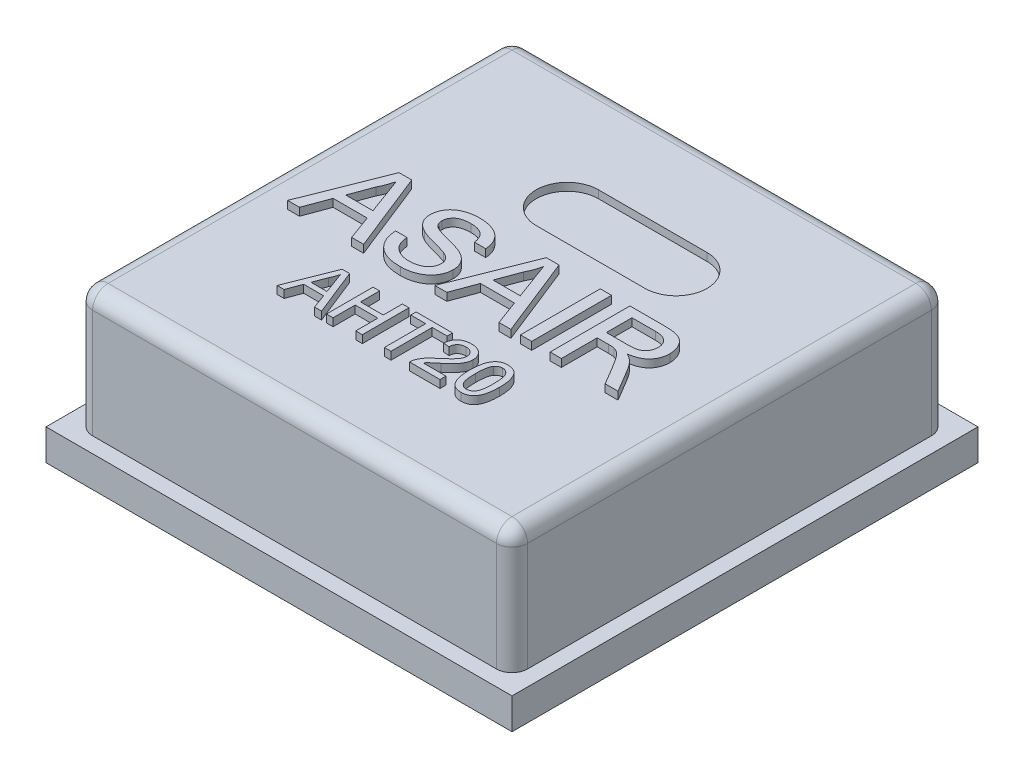
from build123d import *

# Parameters (mm, degrees)
SKETCH_1_W          = 3
SKETCH_1_H          = 3
EXTRUDE_1_DEPTH     = 0.2
SKETCH_5_W          = 0.55
SKETCH_5_H          = 0.4
EXTRUDE_4_DEPTH     = 0.05
EXTRUDE_5_DEPTH     = 0.8
FILLET_2_R          = 0.1
CUT_EXTRUDE_2_DEPTH = 0.05
SKETCH_8_W          = 0.072439758
SKETCH_8_H          = 0.513663737
EXTRUDE_6_DEPTH     = 0.05


with BuildPart() as part:
    # Эскиз1 → Бобышка-Вытянуть1 (new body)
    with BuildSketch(Plane(origin=(0, 0, 0), x_dir=(1, 0, 0), z_dir=(0, 1, 0))):
        Rectangle(SKETCH_1_W, SKETCH_1_H)
    extrude(amount=EXTRUDE_1_DEPTH)

    # Эскиз5 → Бобышка-Вытянуть4 (add)
    with BuildSketch(Plane.XZ):
        with Locations((-1, -1)):
            Rectangle(SKETCH_5_W, SKETCH_5_H)
        with Locations((1, -1)):
            Rectangle(SKETCH_5_W, SKETCH_5_H)
        with Locations((-1, 0)):
            Rectangle(SKETCH_5_W, SKETCH_5_H)
        with Locations((-1, 1)):
            Rectangle(SKETCH_5_W, SKETCH_5_H)
        with Locations((1, 0)):
            Rectangle(SKETCH_5_W, SKETCH_5_H)
        with Locations((1, 1)):
            Rectangle(SKETCH_5_W, SKETCH_5_H)
    extrude(amount=EXTRUDE_4_DEPTH)

    # Эскиз6 → Бобышка-Вытянуть5 (add)
    with BuildSketch(Plane(origin=(0, 0.2, 0), x_dir=(1, 0, 0), z_dir=(0, 1, 0))):
        with BuildLine():
            Line((-1.3, 1.4), (1.3, 1.4))
            ThreePointArc((1.3, 1.4), (1.370710678, 1.370710678), (1.4, 1.3))
            Line((1.4, 1.3), (1.4, -1.3))
            ThreePointArc((1.4, -1.3), (1.370710678, -1.370710678), (1.3, -1.4))
            Line((1.3, -1.4), (-1.3, -1.4))
            ThreePointArc((-1.3, -1.4), (-1.370710678, -1.370710678), (-1.4, -1.3))
            Line((-1.4, -1.3), (-1.4, 1.3))
            ThreePointArc((-1.4, 1.3), (-1.370710678, 1.370710678), (-1.3, 1.4))
        make_face()
    extrude(amount=EXTRUDE_5_DEPTH)

    # Скругление2
    fillet_2_edges = [part.edges().sort_by_distance(p)[0] for p in [
        (1.370710678, 1, -1.370710678),
        (0, 1, -1.4),
        (-1.370710678, 1, -1.370710678),
        (-1.4, 1, 0),
        (-1.370710678, 1, 1.370710678),
        (0, 1, 1.4),
        (1.370710678, 1, 1.370710678),
        (1.4, 1, 0),
    ]]
    fillet(fillet_2_edges, radius=FILLET_2_R)

    # Эскиз7 → Вырез-Вытянуть2 (cut)
    with BuildSketch(Plane(origin=(0, 1, 0), x_dir=(1, 0, 0), z_dir=(0, 1, 0))):
        with BuildLine():
            Line((-0.243969504, 0.8), (0.456030496, 0.8))
            ThreePointArc((0.456030496, 0.8), (0.656030496, 0.6), (0.456030496, 0.4))
            Line((0.456030496, 0.4), (-0.243969504, 0.4))
            ThreePointArc((-0.243969504, 0.4), (-0.443969504, 0.6), (-0.243969504, 0.8))
        make_face()
    extrude(amount=-CUT_EXTRUDE_2_DEPTH, mode=Mode.SUBTRACT)

    # Эскиз8 → Бобышка-Вытянуть6 (add)
    # profile 1 of 10: a face of its own
    with BuildSketch(Plane(origin=(0, 1, 0), x_dir=(1, 0, 0), z_dir=(0, 1, 0))):
        Polygon((-1.134869538, -0.309961255), (-0.930926924, 0.203702482), (-0.849226402, 0.203702482), (-0.645283788, -0.309961255), (-0.722148134, -0.309961255), (-0.780593847, -0.151910874), (-0.999559479, -0.151910874), (-1.058005192, -0.309961255), align=None)
        with BuildLine():
            Line((-0.977745233, -0.092641982), (-0.802408092, -0.092641982))
            Line((-0.802408092, -0.092641982), (-0.852313323, 0.042359385))
            add(Edge.make_bspline(
                [(-0.852313323, 0.042359385), (-0.854226512, 0.047575654), (-0.857967156, 0.057774445), (-0.863545584, 0.072592426), (-0.868641946, 0.08666419), (-0.873639347, 0.099787966), (-0.878150591, 0.112154392), (-0.882308719, 0.123679937), (-0.886421074, 0.134284493), (-0.888888955, 0.141136129), (-0.890076663, 0.144433589)],
                knots=[0, 0, 0, 0, 1.225184869, 2.395467751, 3.491410812, 4.525364584, 5.492066482, 6.394148129, 7.227157926, 8, 8, 8, 8], degree=3))
            add(Edge.make_bspline(
                [(-0.890076663, 0.144433589), (-0.892041361, 0.136302343), (-0.895978858, 0.120006322), (-0.904223017, 0.096130466), (-0.91365405, 0.072472965), (-0.921313172, 0.057228233), (-0.925164671, 0.049562202)],
                knots=[0, 0, 0, 0, 0.9891762, 1.982431084, 2.985436691, 4, 4, 4, 4], degree=3))
            Line((-0.925164671, 0.049562202), (-0.977745233, -0.092641982))
        make_face(mode=Mode.SUBTRACT)
    # profile 2 of 10: a face of its own
    with BuildSketch(Plane(origin=(0, 1, 0), x_dir=(1, 0, 0), z_dir=(0, 1, 0))):
        with BuildLine():
            Line((-0.616781213, -0.132154577), (-0.544341455, -0.132154577))
            add(Edge.make_bspline(
                [(-0.544341455, -0.132154577), (-0.54354466, -0.138658671), (-0.542013973, -0.151153386), (-0.53773402, -0.168862764), (-0.532225445, -0.184785312), (-0.525361912, -0.19913235), (-0.516333195, -0.211731859), (-0.505455145, -0.223096424), (-0.492244345, -0.232937449), (-0.477332363, -0.241695317), (-0.460724577, -0.248571628), (-0.442994284, -0.25366915), (-0.424226043, -0.256689473), (-0.411374706, -0.257078931), (-0.404812604, -0.257277795)],
                knots=[0, 0, 0, 0, 1.125557648, 2.162256852, 3.1243583, 4.018160113, 4.88511607, 5.777380551, 6.711250965, 7.707237736, 8.743031335, 9.791730543, 10.872421559, 12, 12, 12, 12], degree=3))
            add(Edge.make_bspline(
                [(-0.404812604, -0.257277795), (-0.399005708, -0.257170315), (-0.387683386, -0.256960751), (-0.371304383, -0.254443367), (-0.355891692, -0.250872525), (-0.341732162, -0.245471068), (-0.328878024, -0.238912005), (-0.317715646, -0.230978664), (-0.308185801, -0.222032035), (-0.300723242, -0.211836469), (-0.294860804, -0.201153221), (-0.2905601, -0.190171943), (-0.287998259, -0.178953587), (-0.287671814, -0.171405299), (-0.287509587, -0.167654174)],
                knots=[0, 0, 0, 0, 1.267006637, 2.470417599, 3.611360613, 4.716023143, 5.771382139, 6.754486395, 7.697536124, 8.612899418, 9.501261124, 10.352596716, 11.181322154, 12, 12, 12, 12], degree=3))
            add(Edge.make_bspline(
                [(-0.287509587, -0.167654174), (-0.287683011, -0.163941045), (-0.288021967, -0.156683741), (-0.290230853, -0.146118012), (-0.294429153, -0.136447301), (-0.299876929, -0.127276895), (-0.307455716, -0.118892545), (-0.317030658, -0.111167114), (-0.328812715, -0.104163164), (-0.337606248, -0.100327393), (-0.342250995, -0.098301338)],
                knots=[0, 0, 0, 0, 0.942140154, 1.841411588, 2.718743672, 3.605002079, 4.535543111, 5.568170452, 6.715506882, 8, 8, 8, 8], degree=3))
            add(Edge.make_bspline(
                [(-0.342250995, -0.098301338), (-0.344060657, -0.097558712), (-0.348149012, -0.095880986), (-0.355156261, -0.093659965), (-0.36347125, -0.090787959), (-0.373293739, -0.08783026), (-0.384571144, -0.084701428), (-0.39728469, -0.081160065), (-0.411427272, -0.077394019), (-0.426597782, -0.073385474), (-0.441915374, -0.069309397), (-0.456549545, -0.065229504), (-0.470013677, -0.061087889), (-0.48241806, -0.057100087), (-0.493698745, -0.053095831), (-0.503887749, -0.049184751), (-0.512997774, -0.045446198), (-0.518561831, -0.042697297), (-0.521189544, -0.041399085)],
                knots=[0, 0, 0, 0, 0.499201778, 1.127787504, 1.87543728, 2.745208432, 3.745951656, 4.863402235, 6.114490242, 7.482339553, 8.869366102, 10.161191451, 11.360587006, 12.46547846, 13.487450326, 14.41601931, 15.251940103, 16, 16, 16, 16], degree=3))
            add(Edge.make_bspline(
                [(-0.521189544, -0.041399085), (-0.52723518, -0.038133058), (-0.538904831, -0.031828776), (-0.554610889, -0.020556703), (-0.567844837, -0.008048252), (-0.578550843, 0.00567844), (-0.586940722, 0.020391221), (-0.592601337, 0.036115103), (-0.59647839, 0.052564669), (-0.596840711, 0.063876324), (-0.597024916, 0.069627192)],
                knots=[0, 0, 0, 0, 1.158441928, 2.236094408, 3.251151369, 4.220012324, 5.163146324, 6.095083285, 7.031536583, 8, 8, 8, 8], degree=3))
            add(Edge.make_bspline(
                [(-0.597024916, 0.069627192), (-0.596780439, 0.075995307), (-0.596294178, 0.088661441), (-0.591980774, 0.107248203), (-0.585100813, 0.125133612), (-0.577269327, 0.1393331), (-0.569631898, 0.15007069), (-0.563300411, 0.157803706), (-0.55619841, 0.164951839), (-0.548544612, 0.171614873), (-0.540202198, 0.177693255), (-0.531378143, 0.183436798), (-0.521753067, 0.188373511), (-0.508228403, 0.194656832), (-0.490135661, 0.200931316), (-0.467359163, 0.206398733), (-0.443387646, 0.209618381), (-0.427048097, 0.21006158), (-0.41870375, 0.210287915)],
                knots=[0, 0, 0, 0, 1.199927478, 2.386647047, 3.578628709, 4.806592355, 5.433127754, 6.062729195, 6.689531802, 7.331674828, 7.974827539, 8.635320743, 9.315455226, 10.01318112, 11.447700238, 12.918145351, 14.426146008, 16, 16, 16, 16], degree=3))
            add(Edge.make_bspline(
                [(-0.41870375, 0.210287915), (-0.409570308, 0.210078636), (-0.391785737, 0.209671129), (-0.365944252, 0.206280751), (-0.341841221, 0.20045858), (-0.322938797, 0.193941243), (-0.308964456, 0.187343324), (-0.299036696, 0.182195035), (-0.28982177, 0.176242675), (-0.281236728, 0.16980129), (-0.273201824, 0.162873821), (-0.265923575, 0.155295489), (-0.259085939, 0.147324851), (-0.251050763, 0.135881512), (-0.24238714, 0.120736317), (-0.234896259, 0.101115116), (-0.229749936, 0.080406549), (-0.228748858, 0.066090187), (-0.228240694, 0.058822967)],
                knots=[0, 0, 0, 0, 1.607600973, 3.130308851, 4.577334065, 5.967726088, 6.640410691, 7.296826776, 7.935019992, 8.569057421, 9.185393759, 9.8003086, 10.417295362, 11.032210203, 12.259799365, 13.477607022, 14.719591916, 16, 16, 16, 16], degree=3))
            Line((-0.228240694, 0.058822967), (-0.300680452, 0.058822967))
            add(Edge.make_bspline(
                [(-0.300680452, 0.058822967), (-0.301140723, 0.062501119), (-0.302041338, 0.069698174), (-0.304275645, 0.080116994), (-0.307407692, 0.089793525), (-0.31107628, 0.098818007), (-0.315523377, 0.107096577), (-0.320707404, 0.114708725), (-0.326691494, 0.121564769), (-0.333321668, 0.12784587), (-0.340799682, 0.133314957), (-0.349087111, 0.138062291), (-0.358197945, 0.142072702), (-0.368124157, 0.145357359), (-0.378867712, 0.147904154), (-0.390453048, 0.149777625), (-0.402875685, 0.150737113), (-0.411430961, 0.150923397), (-0.415822624, 0.151019022)],
                knots=[0, 0, 0, 0, 1.074487479, 2.102453544, 3.083708351, 4.020042547, 4.923259678, 5.803182661, 6.684453325, 7.556870173, 8.445961597, 9.363679789, 10.320905216, 11.327237703, 12.390948353, 13.519046902, 14.726457512, 16, 16, 16, 16], degree=3))
            add(Edge.make_bspline(
                [(-0.415822624, 0.151019022), (-0.420387552, 0.150984614), (-0.42922413, 0.150918008), (-0.441998406, 0.149703864), (-0.453838509, 0.148038017), (-0.464724101, 0.14558075), (-0.474619524, 0.14236418), (-0.483671639, 0.138649779), (-0.491627114, 0.133942663), (-0.498671404, 0.128699548), (-0.504747996, 0.12289833), (-0.509985119, 0.11678525), (-0.514616949, 0.110539914), (-0.518215984, 0.103820946), (-0.521146139, 0.096882806), (-0.52303641, 0.089595078), (-0.524374767, 0.082092566), (-0.524514058, 0.076973453), (-0.524585158, 0.074360471)],
                knots=[0, 0, 0, 0, 1.464176581, 2.834285765, 4.113735764, 5.29917439, 6.409476712, 7.449999357, 8.431575861, 9.367089851, 10.262376129, 11.120706676, 11.948504824, 12.751342953, 13.560717798, 14.359016663, 15.162382702, 16, 16, 16, 16], degree=3))
            add(Edge.make_bspline(
                [(-0.524585158, 0.074360471), (-0.524397956, 0.069941134), (-0.524034616, 0.061363609), (-0.520324377, 0.04917753), (-0.514618003, 0.03806913), (-0.508996316, 0.032025107), (-0.506166526, 0.028982725)],
                knots=[0, 0, 0, 0, 1.050964922, 2.039826012, 3.013306874, 4, 4, 4, 4], degree=3))
            add(Edge.make_bspline(
                [(-0.506166526, 0.028982725), (-0.504382657, 0.027462289), (-0.50043774, 0.024099937), (-0.493097615, 0.019650259), (-0.483996947, 0.015154425), (-0.473074929, 0.010685219), (-0.460350352, 0.006188384), (-0.445843742, 0.00155834), (-0.429499843, -0.00304016), (-0.411816735, -0.007471575), (-0.393952674, -0.011920805), (-0.37697581, -0.016353078), (-0.361388175, -0.020553652), (-0.3472145, -0.024650625), (-0.334440115, -0.028632411), (-0.323109416, -0.032582433), (-0.313130733, -0.036215452), (-0.30701761, -0.038771577), (-0.304178963, -0.039958521)],
                knots=[0, 0, 0, 0, 0.523891492, 1.158553688, 1.913783773, 2.794766643, 3.797521443, 4.933638669, 6.202080764, 7.596537849, 9.013317056, 10.322179469, 11.523240428, 12.626146501, 13.623953177, 14.517289671, 15.311498917, 16, 16, 16, 16], degree=3))
            add(Edge.make_bspline(
                [(-0.304178963, -0.039958521), (-0.300485739, -0.041661335), (-0.293236559, -0.045003672), (-0.282967125, -0.05071021), (-0.273384629, -0.056636143), (-0.264566491, -0.062941017), (-0.256541225, -0.069638093), (-0.249219098, -0.076650638), (-0.242555888, -0.083939241), (-0.236820454, -0.091737179), (-0.231670622, -0.099729224), (-0.227164177, -0.108027075), (-0.223535674, -0.116679531), (-0.22035325, -0.125582295), (-0.218064174, -0.13483439), (-0.216269078, -0.144342364), (-0.215222028, -0.154150908), (-0.215121001, -0.160791914), (-0.215069829, -0.164155663)],
                knots=[0, 0, 0, 0, 1.198900896, 2.353241543, 3.461831299, 4.520043694, 5.547003373, 6.541368882, 7.508191797, 8.454912692, 9.392021408, 10.310662301, 11.235020644, 12.156274873, 13.095836685, 14.042125239, 15.00831306, 16, 16, 16, 16], degree=3))
            add(Edge.make_bspline(
                [(-0.215069829, -0.164155663), (-0.2153379, -0.170868791), (-0.215870111, -0.184196582), (-0.220452638, -0.203842362), (-0.227651545, -0.222879013), (-0.236094047, -0.237985644), (-0.244074763, -0.249524915), (-0.250778941, -0.257818816), (-0.258213489, -0.26548779), (-0.266195375, -0.272772094), (-0.274786573, -0.279523103), (-0.28405951, -0.285743116), (-0.293916316, -0.291496883), (-0.307991587, -0.298508185), (-0.326685885, -0.305842672), (-0.350498668, -0.311950585), (-0.375594456, -0.315912939), (-0.392826774, -0.316332518), (-0.401622785, -0.316546687)],
                knots=[0, 0, 0, 0, 1.197055466, 2.376552968, 3.581957237, 4.820753935, 5.454298064, 6.085440993, 6.72202542, 7.359198513, 8.013298489, 8.67051481, 9.351020706, 10.049282741, 11.476266879, 12.925760103, 14.430794493, 16, 16, 16, 16], degree=3))
            add(Edge.make_bspline(
                [(-0.401622785, -0.316546687), (-0.407215471, -0.316500534), (-0.418170745, -0.316410126), (-0.434268296, -0.315315258), (-0.449694873, -0.313731477), (-0.464435337, -0.311372418), (-0.478443465, -0.30827746), (-0.491769537, -0.304561014), (-0.504445142, -0.30028076), (-0.51642599, -0.295247256), (-0.527680806, -0.289398874), (-0.538411963, -0.283089949), (-0.548444053, -0.275938487), (-0.557798195, -0.268056863), (-0.566711402, -0.259672769), (-0.57481425, -0.250443805), (-0.582382215, -0.240639861), (-0.589242369, -0.230171206), (-0.595370873, -0.219174805), (-0.600882143, -0.207835331), (-0.605525466, -0.196070525), (-0.609267543, -0.183939846), (-0.612437271, -0.171524473), (-0.614635404, -0.15872082), (-0.616251545, -0.145569088), (-0.616603614, -0.136652492), (-0.616781213, -0.132154577)],
                knots=[0, 0, 0, 0, 1.259822038, 2.467811403, 3.633536148, 4.752793854, 5.829021491, 6.863980041, 7.868367876, 8.841470325, 9.788447787, 10.724101269, 11.643985084, 12.560193707, 13.478453146, 14.398077254, 15.323914234, 16.266973849, 17.21495974, 18.158525798, 19.105629373, 20.061269543, 21.017128399, 21.990322895, 22.986232211, 24, 24, 24, 24], degree=3))
        make_face()
    # profile 3 of 10: a face of its own
    with BuildSketch(Plane(origin=(0, 1, 0), x_dir=(1, 0, 0), z_dir=(0, 1, 0))):
        Polygon((-0.186567254, -0.309961255), (0.01737536, 0.203702482), (0.099075882, 0.203702482), (0.303018495, -0.309961255), (0.22615415, -0.309961255), (0.167708436, -0.151910874), (-0.051257195, -0.151910874), (-0.109702909, -0.309961255), align=None)
        with BuildLine():
            Line((-0.02944295, -0.092641982), (0.145894191, -0.092641982))
            Line((0.145894191, -0.092641982), (0.09598896, 0.042359385))
            add(Edge.make_bspline(
                [(0.09598896, 0.042359385), (0.094075772, 0.047575654), (0.090335127, 0.057774445), (0.0847567, 0.072592426), (0.079660338, 0.08666419), (0.074662936, 0.099787966), (0.070151693, 0.112154392), (0.065993564, 0.123679937), (0.06188121, 0.134284493), (0.059413329, 0.141136129), (0.058225621, 0.144433589)],
                knots=[0, 0, 0, 0, 1.225184869, 2.395467751, 3.491410812, 4.525364584, 5.492066482, 6.394148129, 7.227157926, 8, 8, 8, 8], degree=3))
            add(Edge.make_bspline(
                [(0.058225621, 0.144433589), (0.056260923, 0.136302343), (0.052323426, 0.120006322), (0.044079266, 0.096130466), (0.034648234, 0.072472965), (0.026989112, 0.057228233), (0.023137613, 0.049562202)],
                knots=[0, 0, 0, 0, 0.9891762, 1.982431084, 2.985436691, 4, 4, 4, 4], degree=3))
            Line((0.023137613, 0.049562202), (-0.02944295, -0.092641982))
        make_face(mode=Mode.SUBTRACT)
    # profile 4 of 10: a face of its own
    with BuildSketch(Plane(origin=(0, 1, 0), x_dir=(1, 0, 0), z_dir=(0, 1, 0))):
        with Locations((0.400668112, -0.053129387)):
            Rectangle(SKETCH_8_W, SKETCH_8_H)
    # profile 5 of 10: a face of its own
    with BuildSketch(Plane(origin=(0, 1, 0), x_dir=(1, 0, 0), z_dir=(0, 1, 0))):
        with BuildLine():
            Line((0.555425776, -0.309961255), (0.555425776, 0.203702482))
            Line((0.555425776, 0.203702482), (0.778301508, 0.203702482))
            add(Edge.make_bspline(
                [(0.778301508, 0.203702482), (0.783549549, 0.203661362), (0.793706519, 0.203581778), (0.808436221, 0.203018413), (0.822184922, 0.201803946), (0.8349779, 0.20049067), (0.846812882, 0.198474966), (0.85767766, 0.196162999), (0.867589006, 0.193411724), (0.876591231, 0.190162256), (0.884943334, 0.186485969), (0.892685102, 0.181950025), (0.90013835, 0.176979597), (0.907026464, 0.171140087), (0.913531118, 0.164746363), (0.919646282, 0.157711549), (0.925281427, 0.149974598), (0.932231703, 0.138901415), (0.939687933, 0.124154268), (0.945900143, 0.105281115), (0.949905665, 0.085539108), (0.950334268, 0.072047733), (0.950551728, 0.065202604)],
                knots=[0, 0, 0, 0, 1.242255013, 2.404239178, 3.487702428, 4.508875116, 5.447164253, 6.327763259, 7.137389581, 7.87956647, 8.591787438, 9.293660819, 10.000726923, 10.709654955, 11.427269343, 12.158170644, 12.913245971, 13.690346794, 15.251572448, 16.809945773, 18.381459854, 20, 20, 20, 20], degree=3))
            add(Edge.make_bspline(
                [(0.950551728, 0.065202604), (0.950451213, 0.060808642), (0.950252689, 0.052130266), (0.948731974, 0.039370729), (0.945980363, 0.027179505), (0.942451964, 0.015449825), (0.937622662, 0.004347879), (0.932028126, -0.006353092), (0.925097291, -0.016359105), (0.917337455, -0.025936604), (0.908439004, -0.034880464), (0.898323659, -0.042868012), (0.88709169, -0.050052829), (0.874690199, -0.05623668), (0.861261941, -0.061889014), (0.846638427, -0.066440546), (0.830878677, -0.07015722), (0.819953286, -0.071956978), (0.814315593, -0.072885684)],
                knots=[0, 0, 0, 0, 0.982609109, 1.940720374, 2.867584677, 3.775009516, 4.675469332, 5.571146231, 6.471115823, 7.392408543, 8.32534739, 9.286126426, 10.269214477, 11.301811357, 12.381622301, 13.524260118, 14.722474812, 16, 16, 16, 16], degree=3))
            add(Edge.make_bspline(
                [(0.814315593, -0.072885684), (0.818451054, -0.074974828), (0.826304445, -0.078942188), (0.837177562, -0.085162973), (0.846394327, -0.091519083), (0.851734065, -0.09606516), (0.854239777, -0.09819844)],
                knots=[0, 0, 0, 0, 1.172304973, 2.226249348, 3.167654437, 4, 4, 4, 4], degree=3))
            add(Edge.make_bspline(
                [(0.854239777, -0.09819844), (0.85909223, -0.102955262), (0.869059512, -0.112726111), (0.882794859, -0.129368729), (0.896111751, -0.147894518), (0.904202766, -0.161283167), (0.908363801, -0.168168661)],
                knots=[0, 0, 0, 0, 0.918110279, 1.885863737, 2.912745394, 4, 4, 4, 4], degree=3))
            Line((0.908363801, -0.168168661), (0.992636758, -0.309961255))
            Line((0.992636758, -0.309961255), (0.909598569, -0.309961255))
            Line((0.909598569, -0.309961255), (0.845596397, -0.201507413))
            add(Edge.make_bspline(
                [(0.845596397, -0.201507413), (0.8432952, -0.19770218), (0.838835859, -0.190328262), (0.832394501, -0.17955901), (0.82607896, -0.169644198), (0.820221404, -0.160300455), (0.814584124, -0.151697412), (0.809221588, -0.143805184), (0.804281376, -0.136520234), (0.798162285, -0.128038657), (0.79104068, -0.118653713), (0.782730255, -0.108988993), (0.774816266, -0.10128344), (0.765070043, -0.093727327), (0.752997871, -0.086659852), (0.742736297, -0.083412542), (0.737759939, -0.081837756)],
                knots=[0, 0, 0, 0, 1.130940588, 2.191577161, 3.191089816, 4.120344442, 4.99615009, 5.80661983, 6.546979556, 7.234477901, 8.466216387, 9.541989141, 10.473533583, 11.269175393, 12.675684693, 14, 14, 14, 14], degree=3))
            add(Edge.make_bspline(
                [(0.737759939, -0.081837756), (0.735672044, -0.081461238), (0.730905317, -0.080601635), (0.722811426, -0.080040227), (0.713004684, -0.079444367), (0.705897571, -0.079461729), (0.702054547, -0.079471116)],
                knots=[0, 0, 0, 0, 0.709978628, 1.620902492, 2.713552433, 4, 4, 4, 4], degree=3))
            Line((0.702054547, -0.079471116), (0.627865534, -0.079471116))
            Line((0.627865534, -0.079471116), (0.627865534, -0.309961255))
            Line((0.627865534, -0.309961255), (0.555425776, -0.309961255))
        make_face()
        with BuildLine():
            Line((0.627865534, -0.020202224), (0.765439336, -0.020202224))
            add(Edge.make_bspline(
                [(0.765439336, -0.020202224), (0.772337807, -0.020094291), (0.785233853, -0.01989252), (0.803266932, -0.018169609), (0.818635128, -0.01543183), (0.831642248, -0.011438459), (0.842570282, -0.005894333), (0.8520746, 0.000862219), (0.859972809, 0.009325505), (0.866543303, 0.01887452), (0.871650682, 0.029382736), (0.875334902, 0.040420075), (0.877746288, 0.051893777), (0.877988996, 0.05970262), (0.87811197, 0.063659144)],
                knots=[0, 0, 0, 0, 1.546323217, 2.890706218, 4.056530419, 5.041445823, 5.928701482, 6.793137403, 7.641659452, 8.509781392, 9.383301667, 10.251423607, 11.114044887, 12, 12, 12, 12], degree=3))
            add(Edge.make_bspline(
                [(0.87811197, 0.063659144), (0.878016363, 0.066542413), (0.877829097, 0.072189891), (0.876847388, 0.08047882), (0.874938712, 0.088355219), (0.872418309, 0.095860722), (0.86905054, 0.102940358), (0.865049768, 0.109648987), (0.860275612, 0.115949425), (0.854807091, 0.121860865), (0.848528235, 0.127239697), (0.841356305, 0.131880464), (0.833347866, 0.135824114), (0.824493609, 0.138954058), (0.814821428, 0.141457504), (0.804276259, 0.143122966), (0.79290633, 0.144328088), (0.785027628, 0.144397765), (0.78097684, 0.144433589)],
                knots=[0, 0, 0, 0, 0.965208469, 1.890559848, 2.786986821, 3.67262109, 4.535197034, 5.405224191, 6.282113641, 7.175449223, 8.095446547, 9.040936516, 10.026471658, 11.075712529, 12.17809725, 13.364958037, 14.645208957, 16, 16, 16, 16], degree=3))
            Line((0.78097684, 0.144433589), (0.627865534, 0.144433589))
            Line((0.627865534, 0.144433589), (0.627865534, -0.020202224))
        make_face(mode=Mode.SUBTRACT)
    # profile 6 of 10: a face of its own
    with BuildSketch(Plane(origin=(0, 1, 0), x_dir=(1, 0, 0), z_dir=(0, 1, 0))):
        Polygon((-0.694344299, -0.817897763), (-0.575233722, -0.517897763), (-0.527517376, -0.517897763), (-0.408406799, -0.817897763), (-0.453298626, -0.817897763), (-0.487433242, -0.72559007), (-0.615317857, -0.72559007), (-0.649452472, -0.817897763), align=None)
        with BuildLine():
            Line((-0.602577472, -0.690974686), (-0.500173626, -0.690974686))
            Line((-0.500173626, -0.690974686), (-0.529320261, -0.612128532))
            add(Edge.make_bspline(
                [(-0.529320261, -0.612128532), (-0.530437639, -0.609082024), (-0.532622323, -0.603125526), (-0.535880347, -0.594471237), (-0.538856824, -0.586252769), (-0.541775505, -0.578587962), (-0.54441025, -0.571365479), (-0.546838762, -0.564634104), (-0.54924054, -0.558440622), (-0.550681881, -0.554438995), (-0.551375549, -0.552513147)],
                knots=[0, 0, 0, 0, 1.225184869, 2.395467751, 3.491410812, 4.525364584, 5.492066482, 6.394148129, 7.227157926, 8, 8, 8, 8], degree=3))
            add(Edge.make_bspline(
                [(-0.551375549, -0.552513147), (-0.552523011, -0.557262118), (-0.554822665, -0.56677964), (-0.559637581, -0.580724088), (-0.565145678, -0.594541007), (-0.56961891, -0.603444535), (-0.571868338, -0.607921801)],
                knots=[0, 0, 0, 0, 0.9891762, 1.982431084, 2.985436691, 4, 4, 4, 4], degree=3))
            Line((-0.571868338, -0.607921801), (-0.602577472, -0.690974686))
        make_face(mode=Mode.SUBTRACT)
    # profile 7 of 10: a face of its own
    with BuildSketch(Plane(origin=(0, 1, 0), x_dir=(1, 0, 0), z_dir=(0, 1, 0))):
        Polygon((-0.376375549, -0.817897763), (-0.376375549, -0.517897763), (-0.334067857, -0.517897763), (-0.334067857, -0.640974686), (-0.187914011, -0.640974686), (-0.187914011, -0.517897763), (-0.145606318, -0.517897763), (-0.145606318, -0.817897763), (-0.187914011, -0.817897763), (-0.187914011, -0.67559007), (-0.334067857, -0.67559007), (-0.334067857, -0.817897763), align=None)
    # profile 8 of 10: a face of its own
    with BuildSketch(Plane(origin=(0, 1, 0), x_dir=(1, 0, 0), z_dir=(0, 1, 0))):
        Polygon((-0.003298626, -0.817897763), (-0.003298626, -0.552513147), (-0.099452472, -0.552513147), (-0.099452472, -0.517897763), (0.135162912, -0.517897763), (0.135162912, -0.552513147), (0.039009066, -0.552513147), (0.039009066, -0.817897763), align=None)
    # profile 9 of 10: a face of its own
    with BuildSketch(Plane(origin=(0, 1, 0), x_dir=(1, 0, 0), z_dir=(0, 1, 0))):
        with BuildLine():
            Line((0.354393682, -0.779436224), (0.354393682, -0.817897763))
            Line((0.354393682, -0.817897763), (0.158239835, -0.817897763))
            add(Edge.make_bspline(
                [(0.158239835, -0.817897763), (0.15823582, -0.815611885), (0.158227802, -0.811047792), (0.15900012, -0.804297788), (0.160209724, -0.797637329), (0.161577424, -0.793366241), (0.162266278, -0.79121507)],
                knots=[0, 0, 0, 0, 1.01057331, 2.01775941, 3.001627217, 4, 4, 4, 4], degree=3))
            add(Edge.make_bspline(
                [(0.162266278, -0.79121507), (0.16353905, -0.787700314), (0.166130625, -0.780543692), (0.171381183, -0.770217685), (0.17755708, -0.759954128), (0.183570185, -0.751598143), (0.189076891, -0.744922295), (0.193694981, -0.739699217), (0.198812672, -0.734352781), (0.204425865, -0.728883964), (0.210480536, -0.723257346), (0.216984947, -0.717454163), (0.224015904, -0.711582564), (0.228924248, -0.707690624), (0.231436951, -0.705698244)],
                knots=[0, 0, 0, 0, 1.204657718, 2.452881516, 3.728232997, 5.065887527, 5.768225529, 6.518857853, 7.313994055, 8.154655305, 9.046094665, 9.979688118, 10.965752482, 12, 12, 12, 12], degree=3))
            add(Edge.make_bspline(
                [(0.231436951, -0.705698244), (0.235297083, -0.702449233), (0.242730011, -0.696193058), (0.253226471, -0.686909474), (0.262813279, -0.67828914), (0.271337775, -0.670180967), (0.278869681, -0.6626636), (0.285426682, -0.655754071), (0.291065197, -0.649473941), (0.295716391, -0.643595898), (0.299640745, -0.63804539), (0.302966289, -0.632631212), (0.305737689, -0.627258791), (0.308045894, -0.621945126), (0.309871488, -0.616667493), (0.31111589, -0.611410517), (0.3119598, -0.60622636), (0.312044234, -0.602776764), (0.312085989, -0.60107084)],
                knots=[0, 0, 0, 0, 1.782554561, 3.432421876, 4.950675607, 6.337395053, 7.588547463, 8.709982106, 9.702713005, 10.569305638, 11.356701089, 12.103210377, 12.812277205, 13.490692607, 14.148717897, 14.782152033, 15.397739362, 16, 16, 16, 16], degree=3))
            add(Edge.make_bspline(
                [(0.312085989, -0.60107084), (0.312044229, -0.59938482), (0.311962298, -0.596076942), (0.311184942, -0.591235882), (0.3101028, -0.586573826), (0.308353306, -0.5821747), (0.306270882, -0.57790823), (0.303599669, -0.573909231), (0.300509626, -0.570078037), (0.296971787, -0.566515659), (0.293107639, -0.56317358), (0.288790005, -0.5603955), (0.284302465, -0.5578944), (0.279490202, -0.555883372), (0.274361038, -0.554406639), (0.268952308, -0.553334911), (0.263264873, -0.552655378), (0.259383598, -0.552561276), (0.257398489, -0.552513147)],
                knots=[0, 0, 0, 0, 0.988194508, 1.938783882, 2.870742509, 3.789494954, 4.709148727, 5.651055405, 6.603531303, 7.592354411, 8.592907906, 9.593461401, 10.59787167, 11.603930315, 12.645063138, 13.723588815, 14.835711238, 16, 16, 16, 16], degree=3))
            add(Edge.make_bspline(
                [(0.257398489, -0.552513147), (0.255313187, -0.552561038), (0.251232098, -0.552654763), (0.245266639, -0.553337006), (0.239603469, -0.554379382), (0.234256106, -0.555973085), (0.229231059, -0.557980759), (0.224548792, -0.560507886), (0.220134325, -0.563360555), (0.216126684, -0.5667379), (0.212502627, -0.570482687), (0.209285308, -0.574559627), (0.206649199, -0.579047397), (0.204472191, -0.583847321), (0.202721695, -0.588974488), (0.201450894, -0.594468093), (0.200758045, -0.600312276), (0.200618719, -0.60431437), (0.200547528, -0.606359301)],
                knots=[0, 0, 0, 0, 1.131143733, 2.213731411, 3.253917892, 4.251203413, 5.236093891, 6.184197493, 7.13373276, 8.082770301, 9.020476205, 9.957489029, 10.893177274, 11.836722509, 12.812818608, 13.827831385, 14.890097571, 16, 16, 16, 16], degree=3))
            Line((0.200547528, -0.606359301), (0.162085989, -0.602513147))
            add(Edge.make_bspline(
                [(0.162085989, -0.602513147), (0.162479505, -0.59916113), (0.163245057, -0.59264007), (0.165151943, -0.583195412), (0.167829037, -0.574409172), (0.171032406, -0.566158853), (0.175048131, -0.5585849), (0.179587563, -0.551530653), (0.184941613, -0.545219844), (0.190856418, -0.539453547), (0.197396781, -0.534371922), (0.204501265, -0.529932417), (0.212166621, -0.526219045), (0.220350155, -0.523144528), (0.229070655, -0.520811814), (0.238315783, -0.519139039), (0.248100409, -0.518107921), (0.254811802, -0.517968815), (0.258239835, -0.517897763)],
                knots=[0, 0, 0, 0, 1.130804643, 2.199883102, 3.223565206, 4.205909148, 5.160801384, 6.091796021, 7.01151579, 7.927798993, 8.855738875, 9.7815393, 10.730299821, 11.705391175, 12.706931101, 13.751121791, 14.851322166, 16, 16, 16, 16], degree=3))
            add(Edge.make_bspline(
                [(0.258239835, -0.517897763), (0.2617089, -0.517957167), (0.268466659, -0.518072886), (0.2783138, -0.519256923), (0.287604849, -0.52110105), (0.296373868, -0.523671199), (0.304569047, -0.52704143), (0.312196692, -0.531159092), (0.319291971, -0.535984017), (0.325736336, -0.541574127), (0.331547389, -0.547676668), (0.33663992, -0.554189394), (0.340897521, -0.561084484), (0.344522604, -0.568267952), (0.347211462, -0.575891581), (0.349102316, -0.583851726), (0.350387207, -0.592155188), (0.350493377, -0.597820659), (0.350547528, -0.600710263)],
                knots=[0, 0, 0, 0, 1.195390245, 2.328627238, 3.413424916, 4.457841177, 5.473507151, 6.462241215, 7.441013641, 8.425227782, 9.397253344, 10.342087291, 11.269524934, 12.186751184, 13.110685745, 14.048630397, 15.004728144, 16, 16, 16, 16], degree=3))
            add(Edge.make_bspline(
                [(0.350547528, -0.600710263), (0.35046484, -0.603679003), (0.350299283, -0.609623035), (0.349007087, -0.618507609), (0.346796124, -0.627295766), (0.343864978, -0.636094462), (0.339860422, -0.644938621), (0.334801346, -0.653950245), (0.32852501, -0.663162625), (0.322488933, -0.670994172), (0.316870326, -0.677558982), (0.311889962, -0.682962205), (0.306127968, -0.688702768), (0.2998005, -0.69497948), (0.292649492, -0.701569567), (0.28488041, -0.708670374), (0.276323184, -0.716095034), (0.270382801, -0.721167205), (0.267314355, -0.723787186)],
                knots=[0, 0, 0, 0, 0.927118007, 1.856282007, 2.79721255, 3.754929441, 4.749232485, 5.824981375, 6.979078785, 8.228161913, 8.911614355, 9.677694854, 10.522803217, 11.452009355, 12.461436787, 13.560019032, 14.739651695, 16, 16, 16, 16], degree=3))
            add(Edge.make_bspline(
                [(0.267314355, -0.723787186), (0.264686694, -0.725926382), (0.259676149, -0.7300055), (0.252547678, -0.735919106), (0.246162736, -0.741341723), (0.240372013, -0.746096474), (0.235386402, -0.750413342), (0.231030293, -0.754103267), (0.227461945, -0.757351776), (0.222027983, -0.762286326), (0.215145406, -0.769320029), (0.210074029, -0.776154482), (0.207638874, -0.779436224)],
                knots=[0, 0, 0, 0, 1.241996727, 2.368296581, 3.394949853, 4.3125351, 5.114548721, 5.812230366, 6.404953749, 6.883082049, 8.503329734, 10, 10, 10, 10], degree=3))
            Line((0.207638874, -0.779436224), (0.354393682, -0.779436224))
        make_face()
    # profile 10 of 10: a face of its own
    with BuildSketch(Plane(origin=(0, 1, 0), x_dir=(1, 0, 0), z_dir=(0, 1, 0))):
        with BuildLine():
            add(Edge.make_bspline(
                [(0.396701374, -0.669941032), (0.396740124, -0.665653757), (0.396816019, -0.65725679), (0.397286771, -0.644970518), (0.398108665, -0.633302755), (0.399335527, -0.622263633), (0.400788361, -0.611828235), (0.402677055, -0.602011453), (0.404802111, -0.592791261), (0.407351795, -0.58417727), (0.410153065, -0.576095415), (0.413331194, -0.568558662), (0.41690702, -0.561575002), (0.420704814, -0.555072009), (0.4249245, -0.549150832), (0.429311384, -0.543645298), (0.434184281, -0.538757318), (0.439340565, -0.534361123), (0.444856163, -0.530481736), (0.450701892, -0.527134294), (0.45685526, -0.524178743), (0.463433542, -0.521953806), (0.470300176, -0.52014001), (0.477508016, -0.51880576), (0.485065006, -0.518019174), (0.490229147, -0.517938691), (0.49285522, -0.517897763)],
                knots=[0, 0, 0, 0, 1.514747001, 2.966751498, 4.343369068, 5.64627492, 6.890416844, 8.064737671, 9.177176366, 10.232018008, 11.237056675, 12.19799043, 13.119080079, 14.007588942, 14.855863561, 15.685992447, 16.491747269, 17.290132607, 18.077525251, 18.870243746, 19.668095604, 20.485086593, 21.319398728, 22.175900658, 23.072407314, 24, 24, 24, 24], degree=3))
            add(Edge.make_bspline(
                [(0.49285522, -0.517897763), (0.496708011, -0.518011032), (0.504276974, -0.518233554), (0.5153277, -0.520048405), (0.525742296, -0.523152986), (0.535513997, -0.5273412), (0.544475757, -0.532661038), (0.552478986, -0.539128111), (0.559437358, -0.546674517), (0.56527493, -0.555389678), (0.570377552, -0.565033172), (0.574910609, -0.575648282), (0.57900836, -0.587223112), (0.581916214, -0.597584202), (0.583990384, -0.606528261), (0.58536332, -0.613905069), (0.586503131, -0.621864686), (0.587376381, -0.630387856), (0.588092862, -0.639465019), (0.588646167, -0.649101827), (0.588927027, -0.659322366), (0.588981207, -0.666335121), (0.589009066, -0.669941032)],
                knots=[0, 0, 0, 0, 1.134486744, 2.228744715, 3.287356444, 4.328707449, 5.352829806, 6.347195599, 7.349461267, 8.364207941, 9.428085653, 10.559314403, 11.761222316, 13.04268526, 13.726896727, 14.465273606, 15.252205015, 16.094778733, 16.988606776, 17.934225168, 18.937792761, 20, 20, 20, 20], degree=3))
            add(Edge.make_bspline(
                [(0.589009066, -0.669941032), (0.58896959, -0.674208169), (0.588892466, -0.682544862), (0.588434329, -0.694732618), (0.58756291, -0.706312354), (0.586490612, -0.717310595), (0.584868451, -0.72769798), (0.583120484, -0.737518645), (0.580958682, -0.746727993), (0.578436365, -0.755330061), (0.575595664, -0.763370334), (0.572480396, -0.770909575), (0.569029937, -0.777942634), (0.565141589, -0.784400913), (0.560993262, -0.790370134), (0.556554572, -0.795872691), (0.551731416, -0.800829384), (0.546528666, -0.805212393), (0.541051795, -0.809160575), (0.535191854, -0.812541067), (0.528974491, -0.815341746), (0.522441247, -0.817736187), (0.515525832, -0.819490693), (0.508282782, -0.82083374), (0.500685409, -0.821624623), (0.495501294, -0.821703604), (0.49285522, -0.821743917)],
                knots=[0, 0, 0, 0, 1.508974709, 2.94807912, 4.311757619, 5.615040294, 6.854280449, 8.028314546, 9.141715822, 10.197470207, 11.196696834, 12.155719058, 13.080757287, 13.963948316, 14.818758719, 15.649605906, 16.461113142, 17.260189315, 18.052359509, 18.845763934, 19.647754795, 20.461145776, 21.303032214, 22.167241874, 23.064524267, 24, 24, 24, 24], degree=3))
            add(Edge.make_bspline(
                [(0.49285522, -0.821743917), (0.48938591, -0.821644954), (0.482621711, -0.821452005), (0.472743097, -0.820141035), (0.46347149, -0.817833665), (0.454728691, -0.814739157), (0.44661297, -0.810600074), (0.439085579, -0.805564071), (0.43199526, -0.799748317), (0.427913641, -0.79515982), (0.425848008, -0.792837667)],
                knots=[0, 0, 0, 0, 1.10322584, 2.150986741, 3.161425019, 4.136713905, 5.093944212, 6.049774532, 7.013026876, 8, 8, 8, 8], degree=3))
            add(Edge.make_bspline(
                [(0.425848008, -0.792837667), (0.423470418, -0.789407958), (0.418567726, -0.782335752), (0.41282955, -0.770276986), (0.407710995, -0.757001977), (0.403693868, -0.742250271), (0.400547456, -0.726139276), (0.398274961, -0.708637378), (0.396988952, -0.689752139), (0.396799397, -0.676693809), (0.396701374, -0.669941032)],
                knots=[0, 0, 0, 0, 0.779365345, 1.607084704, 2.489375761, 3.438383567, 4.461919411, 5.557722155, 6.737039282, 8, 8, 8, 8], degree=3))
        make_face()
        with BuildLine():
            add(Edge.make_bspline(
                [(0.435162912, -0.66982084), (0.435201102, -0.675590931), (0.435274204, -0.686636162), (0.43603795, -0.702416179), (0.437352706, -0.71665191), (0.4390909, -0.729323641), (0.441386019, -0.740448516), (0.444267814, -0.749998185), (0.447516281, -0.758087264), (0.451536198, -0.764615497), (0.455937563, -0.769936958), (0.460481671, -0.774513588), (0.46527543, -0.778403618), (0.470287561, -0.781647109), (0.475595831, -0.784102868), (0.481142195, -0.785882808), (0.48692786, -0.786907135), (0.49086816, -0.787054312), (0.49285522, -0.787128532)],
                knots=[0, 0, 0, 0, 1.89448813, 3.626469325, 5.185477471, 6.587276848, 7.82441448, 8.910550357, 9.859733512, 10.6775885, 11.416198291, 12.123144072, 12.791880183, 13.439617036, 14.078171869, 14.70637855, 15.347637704, 16, 16, 16, 16], degree=3))
            add(Edge.make_bspline(
                [(0.49285522, -0.787128532), (0.494841782, -0.78705269), (0.498781096, -0.786902298), (0.504580129, -0.785900557), (0.510104913, -0.784028988), (0.515405269, -0.781581903), (0.520453829, -0.77841234), (0.525224045, -0.774507616), (0.529792091, -0.769933705), (0.534173685, -0.764550391), (0.538162976, -0.757991976), (0.54147238, -0.749909486), (0.544309263, -0.740343093), (0.546616976, -0.729223887), (0.54836234, -0.716572189), (0.549669148, -0.702375943), (0.550438004, -0.686616229), (0.550509901, -0.675590957), (0.550547528, -0.66982084)],
                knots=[0, 0, 0, 0, 0.652509534, 1.29391342, 1.924290653, 2.562989607, 3.207355802, 3.876242846, 4.583348185, 5.32723334, 6.150888545, 7.094226006, 8.186903555, 9.424320409, 10.81992305, 12.379283064, 14.105084285, 16, 16, 16, 16], degree=3))
            add(Edge.make_bspline(
                [(0.550547528, -0.66982084), (0.550511105, -0.66417078), (0.550441321, -0.653345479), (0.549652635, -0.637869464), (0.548416692, -0.623872675), (0.546726119, -0.611342208), (0.544479348, -0.600291668), (0.54175432, -0.590697528), (0.538507043, -0.58258025), (0.534646042, -0.575858297), (0.530347975, -0.570344471), (0.525858237, -0.565571775), (0.521064583, -0.561512753), (0.515882085, -0.558256545), (0.510477784, -0.555629558), (0.504727503, -0.553821598), (0.498687763, -0.552710844), (0.494542768, -0.552579799), (0.492434547, -0.552513147)],
                knots=[0, 0, 0, 0, 1.850066095, 3.544656626, 5.0727657, 6.45041401, 7.682899467, 8.762389858, 9.712573485, 10.538438529, 11.291566246, 11.996865408, 12.681389046, 13.341983376, 13.996294293, 14.643563182, 15.31009126, 16, 16, 16, 16], degree=3))
            add(Edge.make_bspline(
                [(0.492434547, -0.552513147), (0.490447612, -0.552565297), (0.48652963, -0.552668128), (0.480793192, -0.553649654), (0.475356837, -0.555290985), (0.470158282, -0.557514326), (0.465327306, -0.560506505), (0.460672325, -0.564000086), (0.45641136, -0.568256625), (0.45384374, -0.571438747), (0.452530701, -0.573066032)],
                knots=[0, 0, 0, 0, 1.021318143, 2.013908504, 2.982026795, 3.937174072, 4.91255697, 5.897578595, 6.924855925, 8, 8, 8, 8], degree=3))
            add(Edge.make_bspline(
                [(0.452530701, -0.573066032), (0.451101202, -0.57545601), (0.448082401, -0.580503141), (0.444704538, -0.589275262), (0.441720667, -0.599300126), (0.439263953, -0.610731974), (0.437486692, -0.623551196), (0.436083613, -0.637742903), (0.435354766, -0.653326909), (0.435228628, -0.664171172), (0.435162912, -0.66982084)],
                knots=[0, 0, 0, 0, 0.671104906, 1.417232262, 2.260109084, 3.195198885, 4.23592645, 5.382417421, 6.636286093, 8, 8, 8, 8], degree=3))
        make_face(mode=Mode.SUBTRACT)
    extrude(amount=EXTRUDE_6_DEPTH)


solid = part.part
